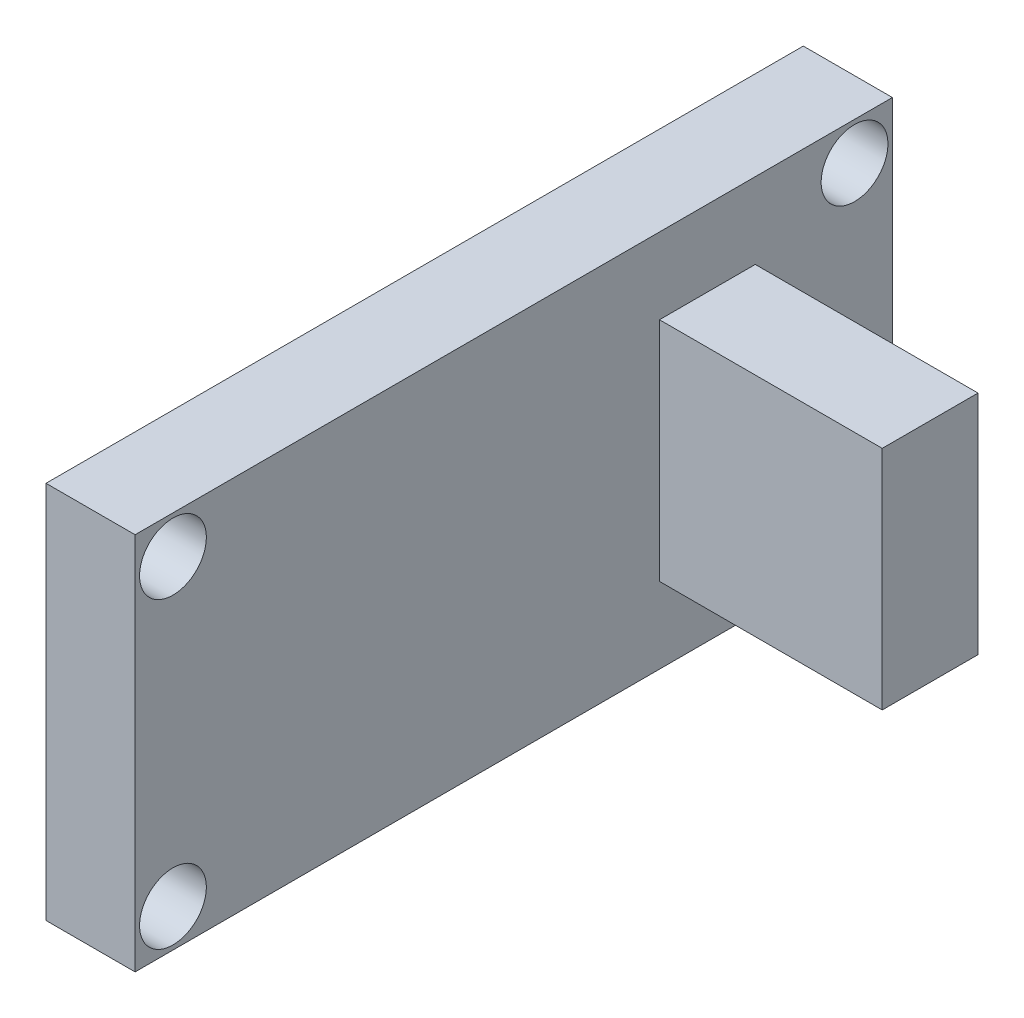
from build123d import *

# Parameters (mm, degrees)
SKETCH1_W           = 34
SKETCH1_H           = 17
BOSS_EXTRUDE1_DEPTH = 4
SKETCH2_R           = 1.5
CUT_EXTRUDE1_DEPTH  = 20.4229246
SKETCH3_W           = 4.299826773
SKETCH3_H           = 10.17393153
BOSS_EXTRUDE2_DEPTH = 10


with BuildPart() as part:
    # Sketch1 → Boss-Extrude1 (new body)
    with BuildSketch(Plane(origin=(0, 0, 0), x_dir=(0, 0, -1), z_dir=(1, 0, 0))):
        Rectangle(SKETCH1_W, SKETCH1_H)
    extrude(amount=BOSS_EXTRUDE1_DEPTH)

    # Sketch2 → Cut-Extrude1 (cut, through all)
    with BuildSketch(Plane(origin=(4, 0, 0), x_dir=(0, 0, -1), z_dir=(1, 0, 0))):
        with Locations((-15.3, 6.8)):
            Circle(SKETCH2_R)
        with Locations((-15.3, -6.8)):
            Circle(SKETCH2_R)
        with Locations(Location((15.3, -6.8, 0), (0, 0, 180))):
            Circle(SKETCH2_R)
        with Locations(Location((15.3, 6.8, 0), (0, 0, 180))):
            Circle(SKETCH2_R)
    extrude(amount=-CUT_EXTRUDE1_DEPTH, mode=Mode.SUBTRACT)

    # Sketch3 → Boss-Extrude2 (add)
    with BuildSketch(Plane(origin=(4, 0, 0), x_dir=(0, 0, -1), z_dir=(1, 0, 0))):
        with Locations((8.693678476, 0)):
            Rectangle(SKETCH3_W, SKETCH3_H)
    extrude(amount=BOSS_EXTRUDE2_DEPTH)


solid = part.part
